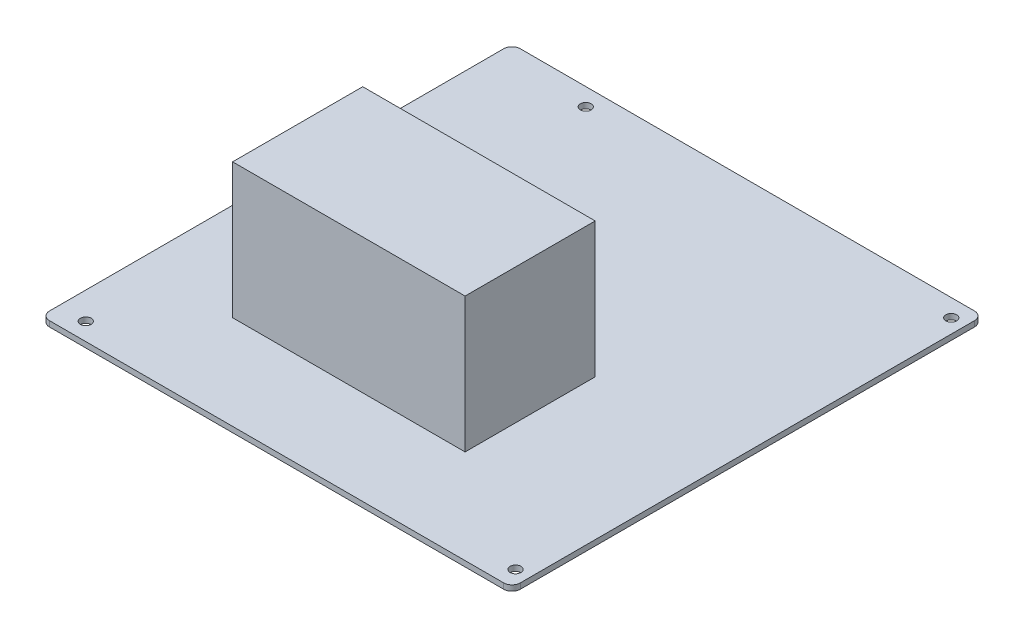
from build123d import *

# Parameters (mm, degrees)
SKETCH1_W                      = 170.18
SKETCH1_H                      = 170.18
BOSS_EXTRUDE1_DEPTH            = 2
SKETCH2_W                      = 84.015738727
SKETCH2_H                      = 47.018762818
BOSS_EXTRUDE2_DEPTH            = 48.8
FILLET1_R                      = 3
F_3_9_3_9_DIAMETER_HOLE1_D     = 3.9
F_3_9_3_9_DIAMETER_HOLE1_DEPTH = 18.75
F_3_9_3_9_DIAMETER_HOLE1_TIP   = 1.171678207


with BuildPart() as part:
    # Sketch1 → Boss-Extrude1 (new body)
    with BuildSketch(Plane(origin=(0, 0, 0), x_dir=(1, 0, 0), z_dir=(0, 1, 0))):
        Rectangle(SKETCH1_W, SKETCH1_H)
    extrude(amount=BOSS_EXTRUDE1_DEPTH)

    # Sketch2 → Boss-Extrude2 (add)
    with BuildSketch(Plane(origin=(0, 2, 0), x_dir=(1, 0, 0), z_dir=(0, 1, 0))):
        with Locations((-7.871346986, -27.578797891)):
            Rectangle(SKETCH2_W, SKETCH2_H)
    extrude(amount=BOSS_EXTRUDE2_DEPTH)

    # Fillet1
    fillet1_edges = [part.edges().sort_by_distance(p)[0] for p in [
        (-85.09, 1, -85.09),
        (85.09, 1, -85.09),
        (85.09, 1, 85.09),
        (-85.09, 1, 85.09),
    ]]
    fillet(fillet1_edges, radius=FILLET1_R)

    # Ø3.9 (3.9) Diameter Hole1
    with Locations(Plane(origin=(0, 2, 0), x_dir=(1, 0, 0), z_dir=(0, 1, 0))):
        with Locations((-75.29, -78.74), (80.01, -78.74), (80.01, 78.74), (-52.07, 78.74)):
            Hole(F_3_9_3_9_DIAMETER_HOLE1_D / 2, depth=F_3_9_3_9_DIAMETER_HOLE1_DEPTH)
            with Locations((0, 0, -(F_3_9_3_9_DIAMETER_HOLE1_DEPTH + F_3_9_3_9_DIAMETER_HOLE1_TIP / 2))):  # 118° drill point
                Cone(0, F_3_9_3_9_DIAMETER_HOLE1_D / 2, F_3_9_3_9_DIAMETER_HOLE1_TIP, mode=Mode.SUBTRACT)


solid = part.part
